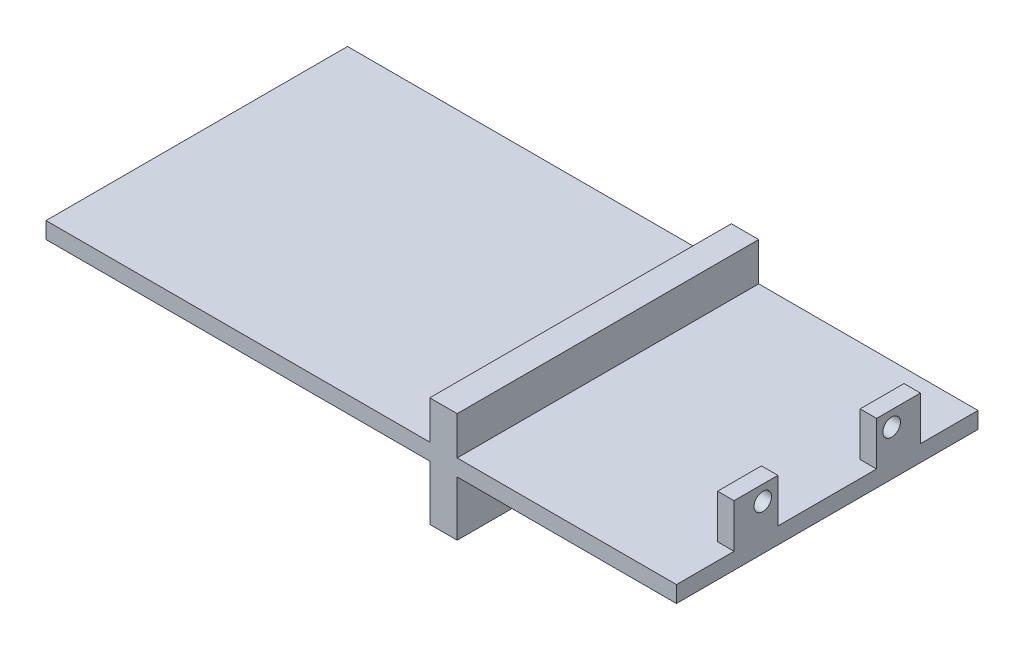
from build123d import *

# Parameters (mm, degrees)
SKETCH2_W                = 70
SKETCH2_H                = 55
BOSS_EXTRUDE3_DEPTH      = 3
BOSS_EXTRUDE4_DEPTH      = 10
BOSS_EXTRUDE4_DEPTH_BACK = 10
SKETCH5_W                = 5
SKETCH5_H                = 55
SKETCH6_W                = 40
SKETCH6_H                = 55
BOSS_EXTRUDE5_DEPTH      = 3
SKETCH8_W                = 3
SKETCH8_H                = 8
BOSS_EXTRUDE6_DEPTH      = 11
SKETCH9_R                = 1.6
CUT_EXTRUDE1_DEPTH       = 11


with BuildPart() as part:
    # Sketch2 → Boss-Extrude3 (new body)
    with BuildSketch(Plane(origin=(0, 0, 0), x_dir=(1, 0, 0), z_dir=(0, 1, 0))):
        with Locations((4.454545455, 9.045454545)):
            Rectangle(SKETCH2_W, SKETCH2_H)
    extrude(amount=BOSS_EXTRUDE3_DEPTH)

    # Sketch5 → Boss-Extrude4 (add, two sides: drawn at the far end of the back side and taken through both)
    with BuildSketch(Plane(origin=(0, 0, 0), x_dir=(1, 0, 0), z_dir=(0, 1, 0)).offset(-BOSS_EXTRUDE4_DEPTH_BACK)):
        with Locations((41.954545455, 9.045454545)):
            Rectangle(SKETCH5_W, SKETCH5_H)
    extrude(amount=BOSS_EXTRUDE4_DEPTH + BOSS_EXTRUDE4_DEPTH_BACK)

    # Sketch6 → Boss-Extrude5 (add)
    with BuildSketch(Plane(origin=(0, 0, 0), x_dir=(1, 0, 0), z_dir=(0, 1, 0))):
        with Locations((64.454545455, 9.045454545)):
            Rectangle(SKETCH6_W, SKETCH6_H)
    extrude(amount=BOSS_EXTRUDE5_DEPTH)

    # Sketch8 → Boss-Extrude6 (add)
    with BuildSketch(Plane(origin=(0, 0, 0), x_dir=(1, 0, 0), z_dir=(0, 1, 0))):
        with Locations((82.954545455, 22.045454545)):
            Rectangle(SKETCH8_W, SKETCH8_H)
        with Locations((82.954545455, -3.954545455)):
            Rectangle(SKETCH8_W, SKETCH8_H)
    extrude(amount=BOSS_EXTRUDE6_DEPTH)

    # Sketch9 → Cut-Extrude1 (cut)
    with BuildSketch(Plane(origin=(84.454545455, 0, 0), x_dir=(0, 0, -1), z_dir=(1, 0, 0))):
        with Locations((-2.704545455, 8.25)):
            Circle(SKETCH9_R)
        with Locations((20.795454545, 8.25)):
            Circle(SKETCH9_R)
    extrude(amount=-CUT_EXTRUDE1_DEPTH, mode=Mode.SUBTRACT)


solid = part.part
